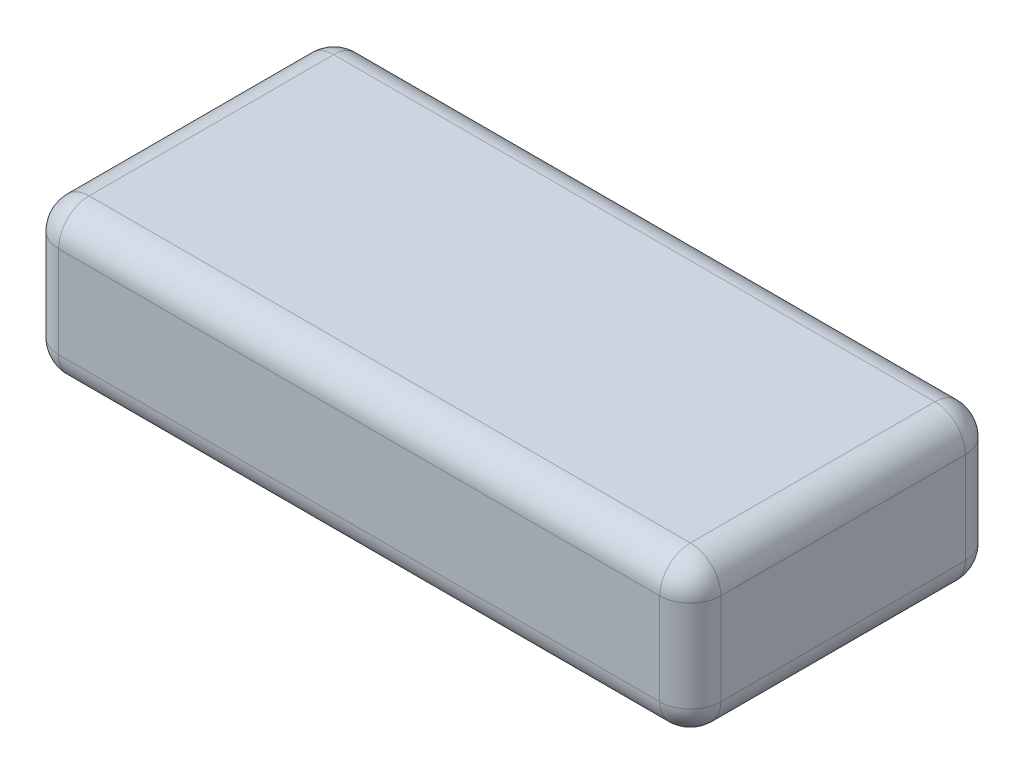
from build123d import *

# Parameters (mm, degrees)
SKETCH1_W           = 65
SKETCH1_H           = 30
BOSS_EXTRUDE1_DEPTH = 15
FILLET1_R           = 3


with BuildPart() as part:
    # Sketch1 → Boss-Extrude1 (new body)
    with BuildSketch(Plane(origin=(0, 0, 0), x_dir=(1, 0, 0), z_dir=(0, 1, 0))):
        Rectangle(SKETCH1_W, SKETCH1_H)
    extrude(amount=BOSS_EXTRUDE1_DEPTH)

    # Fillet1
    fillet1_edges = [part.edges().sort_by_distance(p)[0] for p in [
        (-32.5, 15, 0),
        (0, 15, 15),
        (32.5, 15, 0),
        (0, 0, 15),
        (-32.5, 0, 0),
        (0, 0, -15),
        (32.5, 0, 0),
        (0, 15, -15),
        (32.5, 7.5, 15),
        (-32.5, 7.5, 15),
        (-32.5, 7.5, -15),
        (32.5, 7.5, -15),
    ]]
    fillet(fillet1_edges, radius=FILLET1_R)


solid = part.part
